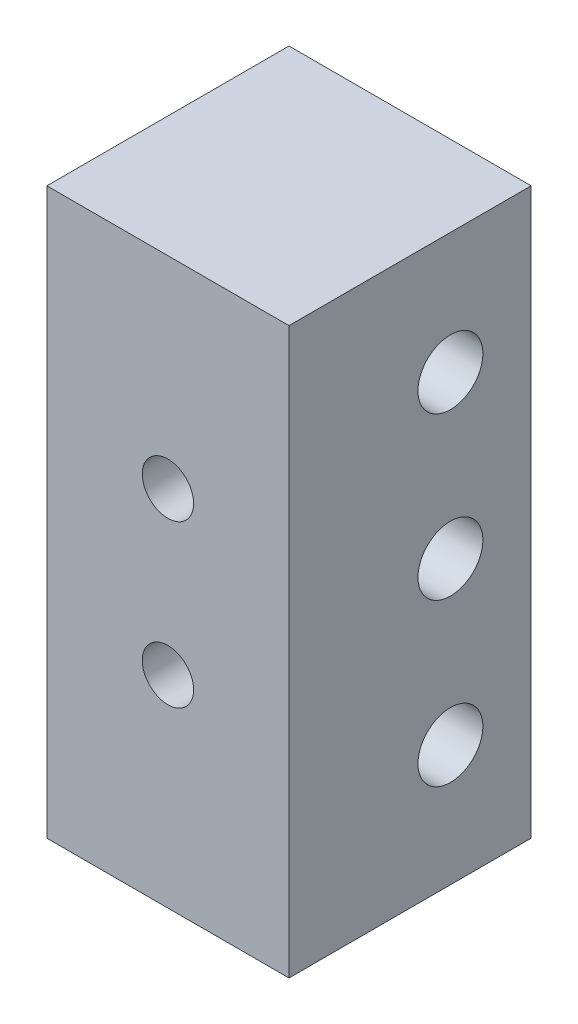
from build123d import *

# Parameters (mm, degrees)
SKETCH1_W              = 19.05
SKETCH1_H              = 19.05
BOSS_EXTRUDE1_DEPTH    = 22.225
SKETCH2_R              = 2.5527
CUT_EXTRUDE1_DEPTH     = 35.925
F_10_32_TAPPED_HOLE1_D = 4.0386


with BuildPart() as part:
    # Sketch1 → Boss-Extrude1 (new, symmetric)
    with BuildSketch(Plane(origin=(0, 0, 0), x_dir=(1, 0, 0), z_dir=(0, 1, 0))):
        with Locations((9.525, 9.525)):
            Rectangle(SKETCH1_W, SKETCH1_H)
    extrude(amount=BOSS_EXTRUDE1_DEPTH, both=True)

    # Sketch2 → Cut-Extrude1 (cut, through all)
    with BuildSketch(Plane.ZY):
        with Locations((-12.7, 12.7)):
            Circle(SKETCH2_R)
        with Locations((-12.7, -12.7)):
            Circle(SKETCH2_R)
        with Locations((-12.7, 0)):
            Circle(SKETCH2_R)
    extrude(amount=-CUT_EXTRUDE1_DEPTH, mode=Mode.SUBTRACT)

    # #10-32 Tapped Hole1 (through all)
    with Locations(Plane(origin=(9.525, -6.35, -19.05), x_dir=(-1, 0, 0), z_dir=(0, 0, -1))):
        with Locations((0, 0), (0, 12.7)):
            Hole(F_10_32_TAPPED_HOLE1_D / 2)


solid = part.part
